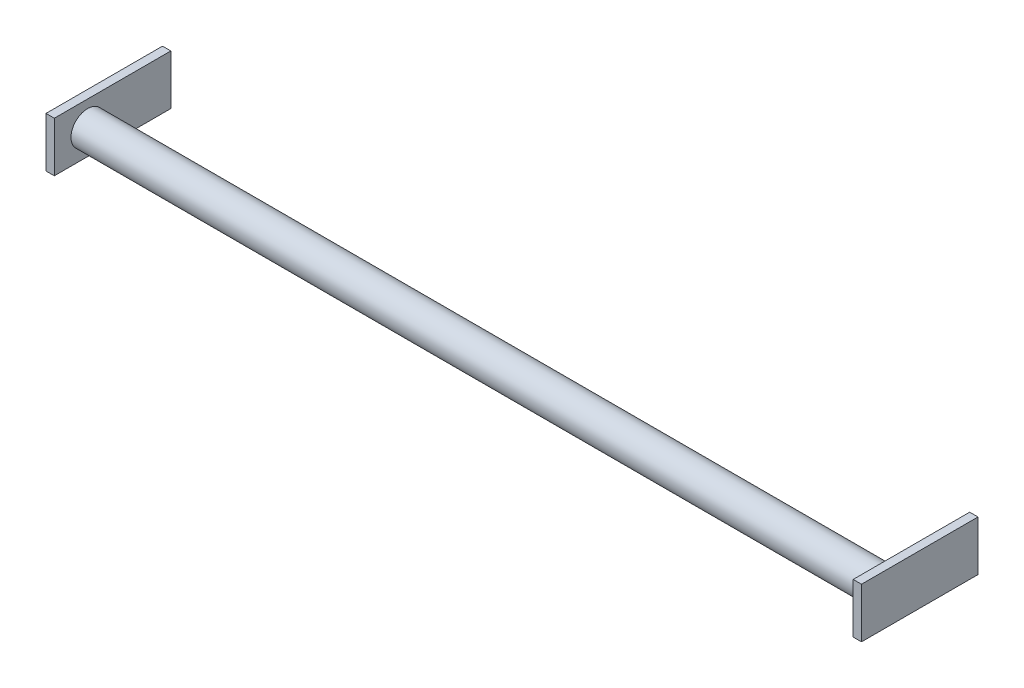
from build123d import *

# Parameters (mm, degrees)
SKETCH1_R           = 12.7
BOSS_EXTRUDE1_DEPTH = 304.8
SKETCH2_W           = 88.9
SKETCH2_H           = 38.1
BOSS_EXTRUDE2_DEPTH = 6.35


with BuildPart() as part:
    # Sketch1 → Boss-Extrude1 (new, symmetric)
    with BuildSketch(Plane(origin=(0, 0, 0), x_dir=(0, 0, -1), z_dir=(1, 0, 0))):
        with Locations(Location((0, 0, 0), (0, 0, 180))):
            Circle(SKETCH1_R)
    extrude(amount=BOSS_EXTRUDE1_DEPTH, both=True)

    # Sketch2 → Boss-Extrude2 (add)
    with BuildSketch(Plane(origin=(304.8, 0, 0), x_dir=(0, 0, -1), z_dir=(1, 0, 0))):
        with Locations((19.05, 0)):
            Rectangle(SKETCH2_W, SKETCH2_H)
    boss_extrude2 = extrude(amount=BOSS_EXTRUDE2_DEPTH)

    # Mirror1: Boss-Extrude2 across plane
    add(boss_extrude2.mirror(Plane(origin=(0, 0, 0), x_dir=(0, 0, 1), z_dir=(1, 0, 0))))


solid = part.part
